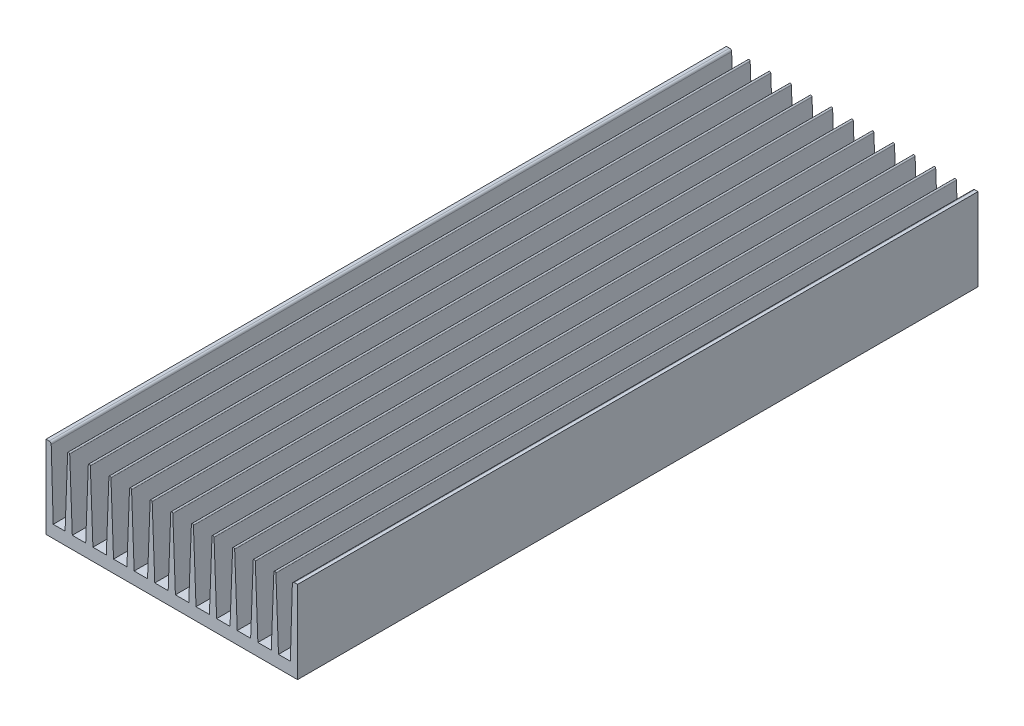
from build123d import *

# Parameters (mm, degrees)
EXTRUDE_1_DEPTH       = 330
EXTRUDE_3_DEPTH       = 330
PATTERN_CURVE_1_COUNT = 11
PATTERN_CURVE_1_PITCH = 10
SKETCH_3_R            = 2.25
CUT_EXTRUDE_1_DEPTH   = 6
SKETCH_4_R            = 1.6
SKETCH_4_R_2          = 2.1
SKETCH_4_R_3          = 2.5
SKETCH_4_R_4          = 1.1
CUT_EXTRUDE_2_DEPTH   = 6


with BuildPart() as part:
    # Эскиз1 → Вытянуть1 (new body)
    with BuildSketch(Plane.XY):
        with BuildLine():
            Line((0, 40), (1.528979332, 40))
            ThreePointArc((1.528979332, 40), (2.225614441, 39.717425624), (2.528547087, 39.029399052))
            Line((2.528547087, 39.029399052), (3.5, 6))
            Line((3.5, 6), (118.5, 6))
            Line((118.5, 6), (119.471452913, 39.029399052))
            ThreePointArc((119.471452913, 39.029399052), (119.774385559, 39.717425624), (120.471020668, 40))
            Line((120.471020668, 40), (122, 40))
            Line((122, 40), (122, 0))
            Line((122, 0), (0, 0))
            Line((0, 0), (0, 40))
        make_face()
    extrude(amount=EXTRUDE_1_DEPTH)

    # Эскиз2 → Вытянуть3 (add)
    with BuildSketch(Plane.XY.offset(330)):
        with BuildLine():
            Line((10.5, 39.5), (9.25, 6))
            Line((9.25, 6), (12.75, 6))
            Line((12.75, 6), (11.5, 39.5))
            ThreePointArc((11.5, 39.5), (11, 40), (10.5, 39.5))
        make_face()
    extrude_3 = extrude(amount=-EXTRUDE_3_DEPTH)

    # Кривая1: Вытянуть3 ×11
    with Locations(*[(i * PATTERN_CURVE_1_PITCH, 0, 0) for i in range(1, PATTERN_CURVE_1_COUNT)]):
        add(extrude_3)

    # Эскиз3 → Вырез-Вытянуть1 (cut)
    with BuildSketch(Plane.XZ):
        with Locations((26, 322)):
            Circle(SKETCH_3_R)
        with Locations((96, 322)):
            Circle(SKETCH_3_R)
        with Locations(Location((96, 8, 0), (0, 0, 180))):
            Circle(SKETCH_3_R)
        with Locations(Location((26, 8, 0), (0, 0, 180))):
            Circle(SKETCH_3_R)
    extrude(amount=-CUT_EXTRUDE_1_DEPTH, mode=Mode.SUBTRACT)

    # Эскиз4 → Вырез-Вытянуть2 (cut)
    with BuildSketch(Plane(origin=(1.487985642, 0, 27.400529356), x_dir=(1, 0, 0), z_dir=(0, -1, 0))):
        with Locations((65.512014358, 131.599470644)):
            Circle(SKETCH_4_R)
        with Locations((103.512014358, 188.999470644)):
            Circle(SKETCH_4_R)
        with Locations((60.512014358, 276.599470644)):
            Circle(SKETCH_4_R)
        with Locations((60.512014358, 141.599470644)):
            Circle(SKETCH_4_R)
        with Locations((65.512014358, -3.400529356)):
            Circle(SKETCH_4_R)
        with Locations((38.512014358, 113.599470644)):
            Circle(SKETCH_4_R_2)
        with Locations((109.632014358, 2.919470644)):
            Circle(SKETCH_4_R_3)
        with Locations((28.012014358, 76.099470644)):
            Circle(SKETCH_4_R)
        with Locations((48.712014358, 22.929470644)):
            Circle(SKETCH_4_R_4)
    extrude(amount=-CUT_EXTRUDE_2_DEPTH, mode=Mode.SUBTRACT)


solid = part.part
